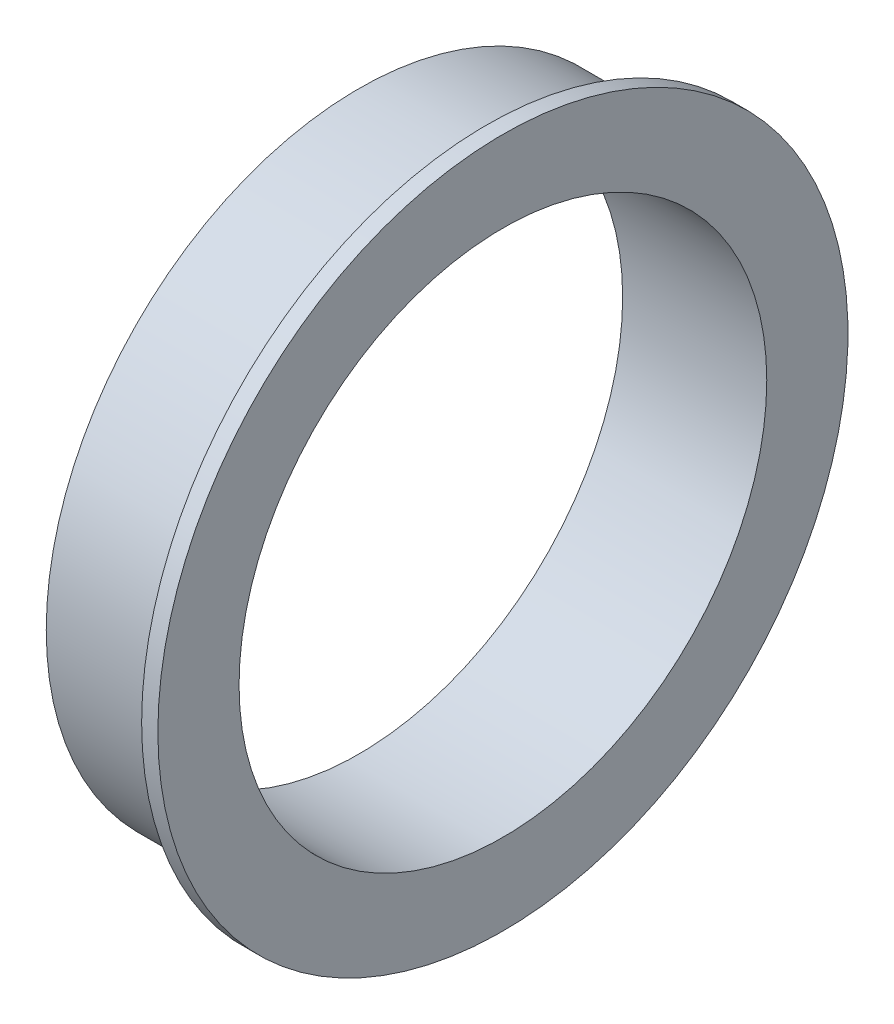
from build123d import *


with BuildPart() as part:
    # Sketch3 → Boccola (revolve)
    with BuildSketch(Plane.XY, mode=Mode.PRIVATE) as boccola_sk:
        Polygon((14.977233333, 77), (46.477233333, 77), (46.477233333, 85), (50.477233333, 85), (50.477233333, 65), (14.977233333, 65), align=None)
    revolve(boccola_sk.sketch.rotate(Axis((-46.2, 0, 0), (1, 0, 0)), 90), axis=Axis((-46.2, 0, 0), (1, 0, 0)))


solid = part.part
